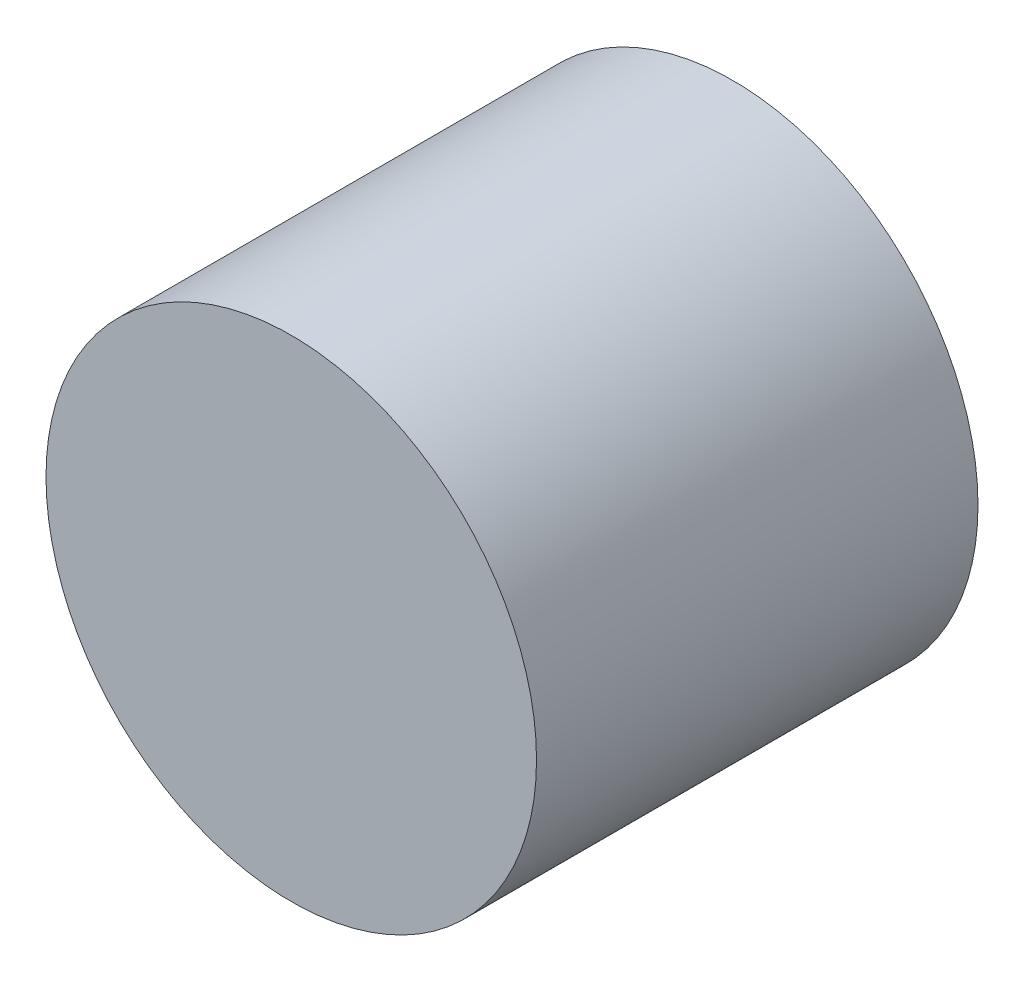
from build123d import *


with BuildPart() as part:
    # Эскиз1 → Повернуть1 (revolve)
    with BuildSketch(Plane(origin=(0, 0, 0), x_dir=(0, 0, -1), z_dir=(1, 0, 0)), mode=Mode.PRIVATE) as revolve_1_sk:
        with BuildLine():
            Line((0, 0), (0, 5))
            Line((0, 5), (9, 5))
            Line((9, 5), (9, 3))
            Line((9, 3), (3.5, 3))
            Line((3.5, 3), (3.5, 4.5))
            ThreePointArc((3.5, 4.5), (2.022517486, 2.46221445), (1.5, 0))
            Line((1.5, 0), (0, 0))
        make_face()
    revolve(revolve_1_sk.sketch.rotate(Axis((0, 0, 9.916167665), (0, 0, -1)), 90), axis=Axis((0, 0, 9.916167665), (0, 0, -1)))


solid = part.part
